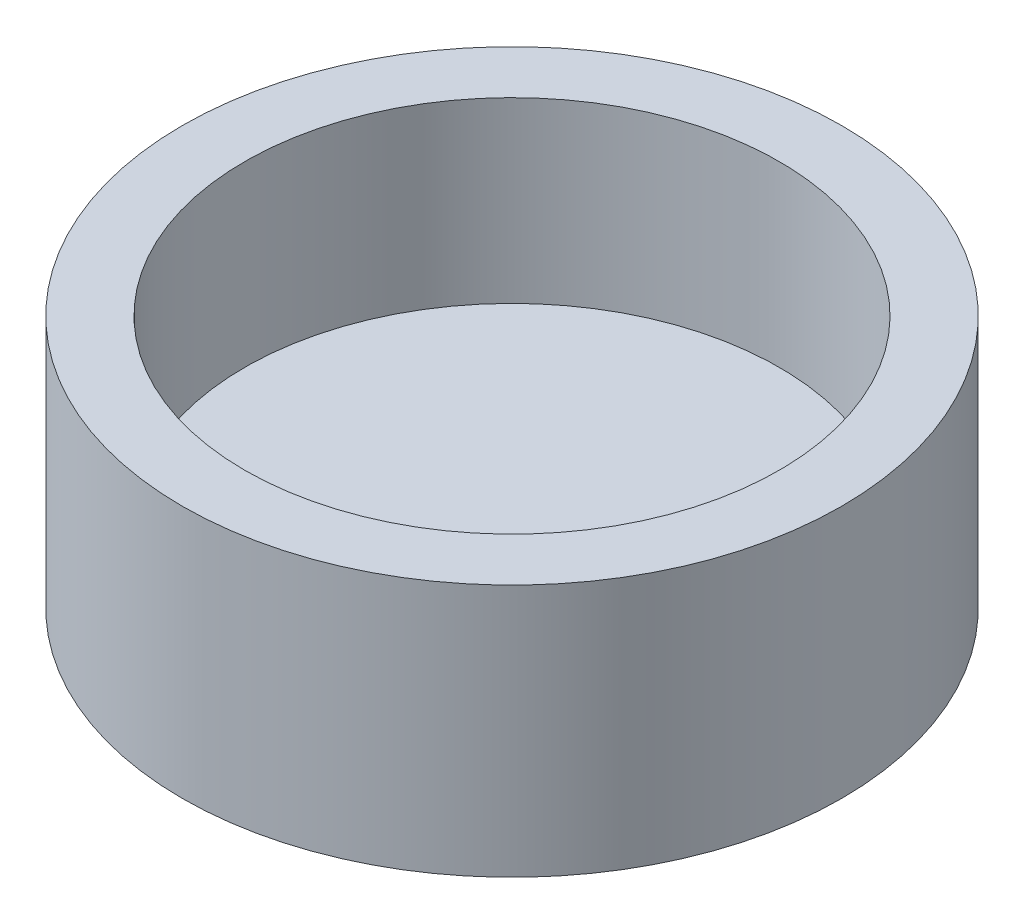
from build123d import *

# Parameters (mm, degrees)
SKETCH1_R           = 9.25
BOSS_EXTRUDE1_DEPTH = 7.1
SKETCH2_R           = 7.5
CUT_EXTRUDE1_DEPTH  = 5


with BuildPart() as part:
    # Sketch1 → Boss-Extrude1 (new body)
    with BuildSketch(Plane(origin=(0, 0, 0), x_dir=(1, 0, 0), z_dir=(0, 1, 0))):
        with Locations(Location((0, 0, 0), (0, 0, 270))):
            Circle(SKETCH1_R)
    extrude(amount=BOSS_EXTRUDE1_DEPTH)

    # Sketch2 → Cut-Extrude1 (cut)
    with BuildSketch(Plane(origin=(0, 7.1, 0), x_dir=(1, 0, 0), z_dir=(0, 1, 0))):
        with Locations(Location((0, 0, 0), (0, 0, 270))):
            Circle(SKETCH2_R)
    extrude(amount=-CUT_EXTRUDE1_DEPTH, mode=Mode.SUBTRACT)


solid = part.part
